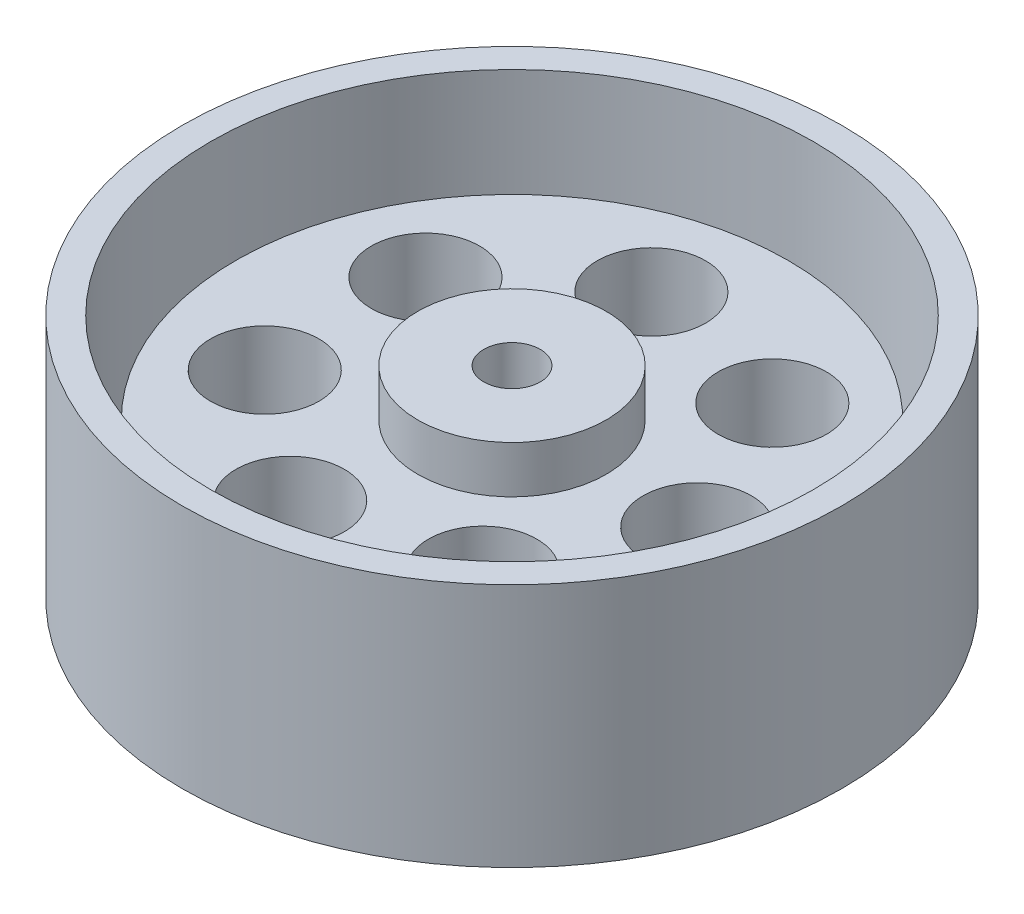
from build123d import *

# Parameters (mm, degrees)
VOLUME_KNOB_R                      = 35
KNOB_TOP_DEPTH                     = 3.5
VOLUME_KNOB_3_R                    = 35
VOLUME_KNOB_3_R_2                  = 32
KNOB_WALLS_DEPTH                   = 26
KNOB_START                         = 3.5
KNOB_SHAFT_KEYWAY_DEPTH            = 10
VOLUME_KNOB_8_R                    = 29.33
VOLUME_KNOB_8_R_2                  = 3
KNOB_DAMEPNING_EXTENSION_TOP_DEPTH = 12.9
KNOB_START_2                       = 16.4
VOLUME_KNOB_11_R                   = 10
VOLUME_KNOB_11_R_2                 = 3
KNOB_SHAFT_SUPPORT_DEPTH           = 5
SKETCH1_R                          = 5.75
WEIGHT_SLUG_HOLES_DEPTH            = 12.7


with BuildPart() as part:
    # Volume Knob → Knob Top (new body)
    with BuildSketch(Plane(origin=(0, 0, 0), x_dir=(1, 0, 0), z_dir=(0, 1, 0))):
        with Locations(Location((0, 0, 0), (0, 0, 270))):
            Circle(VOLUME_KNOB_R)
    extrude(amount=KNOB_TOP_DEPTH)

    # Volume Knob<3> → Knob Walls (add)
    with BuildSketch(Plane(origin=(0, 0, 0), x_dir=(1, 0, 0), z_dir=(0, 1, 0))):
        with Locations(Location((0, 0, 0), (0, 0, 270))):
            Circle(VOLUME_KNOB_3_R)
        with Locations(Location((0, 0, 0), (0, 0, 90))):
            Circle(VOLUME_KNOB_3_R_2, mode=Mode.SUBTRACT)
    extrude(amount=KNOB_WALLS_DEPTH)

    # Volume Knob<4> → Knob Shaft Keyway (add)
    with BuildSketch(Plane(origin=(0, 0, 0), x_dir=(1, 0, 0), z_dir=(0, 1, 0)).offset(KNOB_START)):
        with BuildLine():
            Line((-2.598076211, 1.5), (2.598076211, 1.5))
            ThreePointArc((2.598076211, 1.5), (0, 3), (-2.598076211, 1.5))
        make_face()
    extrude(amount=KNOB_SHAFT_KEYWAY_DEPTH)

    # Volume Knob<8> → Knob Damepning Extension (top) (add)
    with BuildSketch(Plane(origin=(0, 0, 0), x_dir=(1, 0, 0), z_dir=(0, 1, 0)).offset(KNOB_START)):
        with Locations(Location((0, 0, 0), (0, 0, 90))):
            Circle(VOLUME_KNOB_8_R)
        with Locations(Location((0, 0, 0), (0, 0, 150))):
            Circle(VOLUME_KNOB_8_R_2, mode=Mode.SUBTRACT)
    extrude(amount=KNOB_DAMEPNING_EXTENSION_TOP_DEPTH)

    # Volume Knob<11> → Knob Shaft Support (add)
    with BuildSketch(Plane(origin=(0, 0, 0), x_dir=(1, 0, 0), z_dir=(0, 1, 0)).offset(KNOB_START_2)):
        with Locations(Location((0, 0, 0), (0, 0, 270))):
            Circle(VOLUME_KNOB_11_R)
        with Locations(Location((0, 0, 0), (0, 0, 150))):
            Circle(VOLUME_KNOB_11_R_2, mode=Mode.SUBTRACT)
    extrude(amount=KNOB_SHAFT_SUPPORT_DEPTH)

    # Sketch1 → Weight Slug Holes (cut)
    with BuildSketch(Plane(origin=(0, 16.4, 0), x_dir=(1, 0, 0), z_dir=(0, 1, 0))):
        with Locations(Location((19.665, 0, 0), (0, 0, 270))):
            Circle(SKETCH1_R)
        with Locations(Location((12.260926954, -15.374716103, 0), (0, 0, 270))):
            Circle(SKETCH1_R)
        with Locations(Location((-4.375874166, -19.171957393, 0), (0, 0, 270))):
            Circle(SKETCH1_R)
        with Locations(Location((-17.717552787, -8.53232373, 0), (0, 0, 270))):
            Circle(SKETCH1_R)
        with Locations(Location((-17.717552787, 8.53232373, 0), (0, 0, 270))):
            Circle(SKETCH1_R)
        with Locations(Location((-4.375874166, 19.171957393, 0), (0, 0, 270))):
            Circle(SKETCH1_R)
        with Locations(Location((12.260926954, 15.374716103, 0), (0, 0, 270))):
            Circle(SKETCH1_R)
    extrude(amount=-WEIGHT_SLUG_HOLES_DEPTH, mode=Mode.SUBTRACT)


solid = part.part
